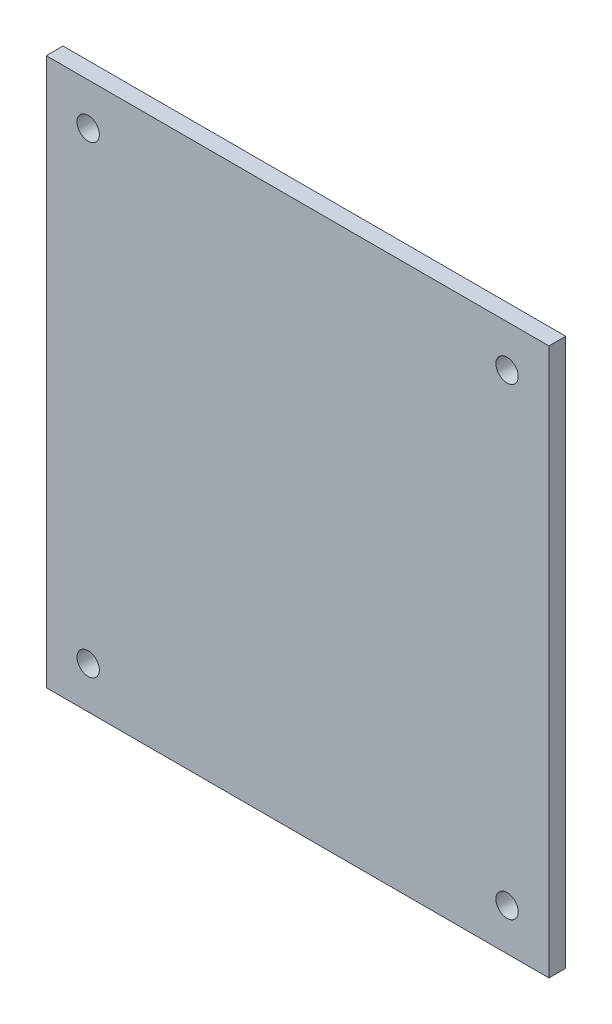
from build123d import *

# Parameters (mm, degrees)
SKETCH2_W               = 45
SKETCH2_H               = 49
BOSS_EXTRUDE1_DEPTH     = 1.5
CUT_EXTRUDE1_DEPTH      = 34.297897832
CUT_EXTRUDE1_DEPTH_BACK = 34.297897832
SKETCH3_R               = 1


with BuildPart() as part:
    # Sketch2 → Boss-Extrude1 (new body)
    with BuildSketch(Plane.XY):
        Rectangle(SKETCH2_W, SKETCH2_H)
    extrude(amount=BOSS_EXTRUDE1_DEPTH)

    # Sketch3 → Cut-Extrude1 (cut, two sides: drawn at the far end of the back side and taken through both)
    with BuildSketch(Plane.XY.offset(1.5).offset(-CUT_EXTRUDE1_DEPTH_BACK)):
        with Locations((-18.75, 20.75)):
            Circle(SKETCH3_R)
        with Locations(Location((18.75, 20.75, 0), (0, 0, 180))):
            Circle(SKETCH3_R)
        with Locations((18.75, -20.75)):
            Circle(SKETCH3_R)
        with Locations(Location((-18.75, -20.75, 0), (0, 0, 180))):
            Circle(SKETCH3_R)
    extrude(amount=CUT_EXTRUDE1_DEPTH + CUT_EXTRUDE1_DEPTH_BACK, mode=Mode.SUBTRACT)


solid = part.part
